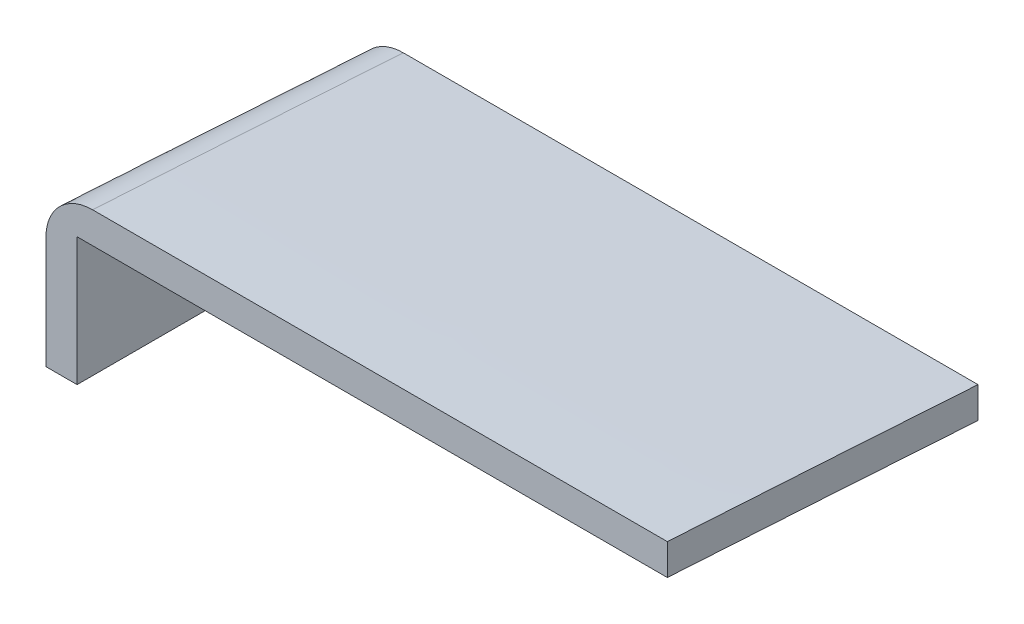
from build123d import *

# Parameters (mm, degrees)
SKETCH_1_W                = 80
SKETCH_1_H                = 100
EXTRUDE_1_DEPTH           = 100
SKETCH_2_W                = 80
SKETCH_2_H                = 85
CUT_EXTRUDE_1_DEPTH       = 90
CUT_EXTRUDE_5_DEPTH       = 138.477270849
SHELL_2_T                 = -2
FILLET_1_R                = 3
FILLET_2_R                = 5
FILLET_3_R                = 3
SKETCH_6_W                = 3.8
SKETCH_6_H                = 2.5
CUT_EXTRUDE_6_DEPTH       = 85
SKETCH_8_W                = 5
SKETCH_8_H                = 5
CUT_EXTRUDE_7_DEPTH       = 100
SKETCH_11_W               = 2
SKETCH_11_H               = 1
CUT_EXTRUDE_8_DEPTH       = 119.74342103
SCALE_1_SCALE             = 5
SKETCH_12_W               = 400
SKETCH_12_H               = 300
SKETCH_12_W_2             = 185
SKETCH_12_H_2             = 29.670884313
CUT_EXTRUDE_14_DEPTH      = 594.717104512
CUT_EXTRUDE_15_DEPTH      = 575.45626481
CUT_EXTRUDE_15_DEPTH_BACK = 575.45626481
SKETCH_17_W               = 200
SKETCH_17_H               = 200


with BuildPart() as part:
    # 스케치1 → 보스-돌출1 (new body)
    with BuildSketch(Plane.XY):
        Rectangle(SKETCH_1_W, SKETCH_1_H)
    extrude(amount=-EXTRUDE_1_DEPTH)

    # 스케치2 → 컷-돌출1 (cut)
    with BuildSketch(Plane(origin=(40, 0, 0), x_dir=(0, 0, -1), z_dir=(1, 0, 0))):
        with Locations((40, 7.5)):
            Rectangle(SKETCH_2_W, SKETCH_2_H)
    extrude(amount=-CUT_EXTRUDE_1_DEPTH, mode=Mode.SUBTRACT)

    # 스케치5 → 컷-돌출5 (cut, through all)
    with BuildSketch(Plane(origin=(40, 0, 0), x_dir=(0, 0, -1), z_dir=(1, 0, 0))):
        with BuildLine():
            add(Edge.make_bspline(
                [(0, -39.376697629), (18.60893103, -37.813832642), (60.522018707, -41.448787519), (82.629316251, -41.815039561), (94.476954899, -29.981594577), (72.35205171, -11.407179683), (96, 50)],
                knots=[0, 0, 0, 0, 0.361871867, 0.526261735, 0.755385015, 1, 1, 1, 1], degree=3))
            Line((96, 50), (80, 50))
            Line((80, 50), (80, -35))
            Line((80, -35), (0, -35))
            Line((0, -35), (0, -39.376697629))
        make_face()
    extrude(amount=-CUT_EXTRUDE_5_DEPTH, mode=Mode.SUBTRACT)

    # 쉘2
    shell_2_openings = [part.faces().sort_by_distance(p)[0] for p in [
        (0, 0, -100),
        (0, -50, -50),
    ]]
    offset(amount=SHELL_2_T, openings=shell_2_openings, kind=Kind.INTERSECTION)

    # 필렛1
    fillet_1_edges = [part.edges().sort_by_distance(p)[0] for p in [
        (0, 50, -96),
    ]]
    fillet(fillet_1_edges, radius=FILLET_1_R)

    # 필렛2
    fillet_2_edges = [part.edges().sort_by_distance(p)[0] for p in [
        (0, -39.376697629, 0),
    ]]
    fillet(fillet_2_edges, radius=FILLET_2_R)

    # 필렛3
    fillet_3_edges = [part.edges().sort_by_distance(p)[0] for p in [
        (40, -47.032911569, 0),
        (40, 49.469386486, -96.360930071),
        (-40, 49.469386486, -96.360930071),
        (40, -34.292790316, -87.583679146),
        (-40, -34.292790311, -87.583679133),
        (40, -40.61329303, -1.383366779),
        (-40, -47.032911569, 0),
        (-40, -40.61329303, -1.383366779),
        (-40, 50, -99.032247048),
        (40, 50, -99.032247048),
    ]]
    fillet(fillet_3_edges, radius=FILLET_3_R)

    # 스케치6 → 컷-돌출6 (cut)
    with BuildSketch(Plane(origin=(0, 0, -100), x_dir=(-1, 0, 0), z_dir=(0, 0, -1))):
        with Locations((-10, 10)):
            Rectangle(SKETCH_6_W, SKETCH_6_H)
        with Locations((10, 10)):
            Rectangle(SKETCH_6_W, SKETCH_6_H)
    extrude(amount=-CUT_EXTRUDE_6_DEPTH, mode=Mode.SUBTRACT)

    # 스케치8 → 컷-돌출7 (cut)
    with BuildSketch(Plane(origin=(0, 50, 0), x_dir=(1, 0, 0), z_dir=(0, 1, 0))):
        with Locations((-20, 69.358931696)):
            Rectangle(SKETCH_8_W, SKETCH_8_H)
        with Locations((20, 69.358931696)):
            Rectangle(SKETCH_8_W, SKETCH_8_H)
    extrude(amount=-CUT_EXTRUDE_7_DEPTH, mode=Mode.SUBTRACT)

    # 스케치11 → 컷-돌출8 (cut, through all)
    with BuildSketch(Plane(origin=(0, 0, -100), x_dir=(-1, 0, 0), z_dir=(0, 0, -1))):
        with Locations((-10, 3.626900341)):
            Rectangle(SKETCH_11_W, SKETCH_11_H)
        with Locations((10, 3.626900341)):
            Rectangle(SKETCH_11_W, SKETCH_11_H)
    extrude(amount=-CUT_EXTRUDE_8_DEPTH, mode=Mode.SUBTRACT)


with BuildPart() as part_1:
    # 축척1: scaled about (0, 0, 0)
    add(part.part.scale(SCALE_1_SCALE))

    # 스케치12 → 컷-돌출14 (cut, through all)
    with BuildSketch(Plane.XY):
        with Locations((0, 100)):
            Rectangle(SKETCH_12_W, SKETCH_12_H)
        Polygon((200, -250), (200, -50), (0, -50), (0, -220.329115687), (185, -220.329115687), (185, -250), align=None)
        with Locations((92.5, -235.164557844)):
            Rectangle(SKETCH_12_W_2, SKETCH_12_H_2)
    extrude(amount=-CUT_EXTRUDE_14_DEPTH, mode=Mode.SUBTRACT)

    # 스케치17 → 컷-돌출15 (cut, two sides: drawn at the far end of the back side and taken through both)
    with BuildSketch(Plane.XZ.offset(250).offset(-CUT_EXTRUDE_15_DEPTH_BACK)):
        with Locations((-100, -100)):
            Rectangle(SKETCH_17_W, SKETCH_17_H)
        with Locations((-100, -400)):
            Rectangle(SKETCH_17_W, SKETCH_17_H)
    extrude(amount=CUT_EXTRUDE_15_DEPTH + CUT_EXTRUDE_15_DEPTH_BACK, mode=Mode.SUBTRACT)


solid = part_1.part
